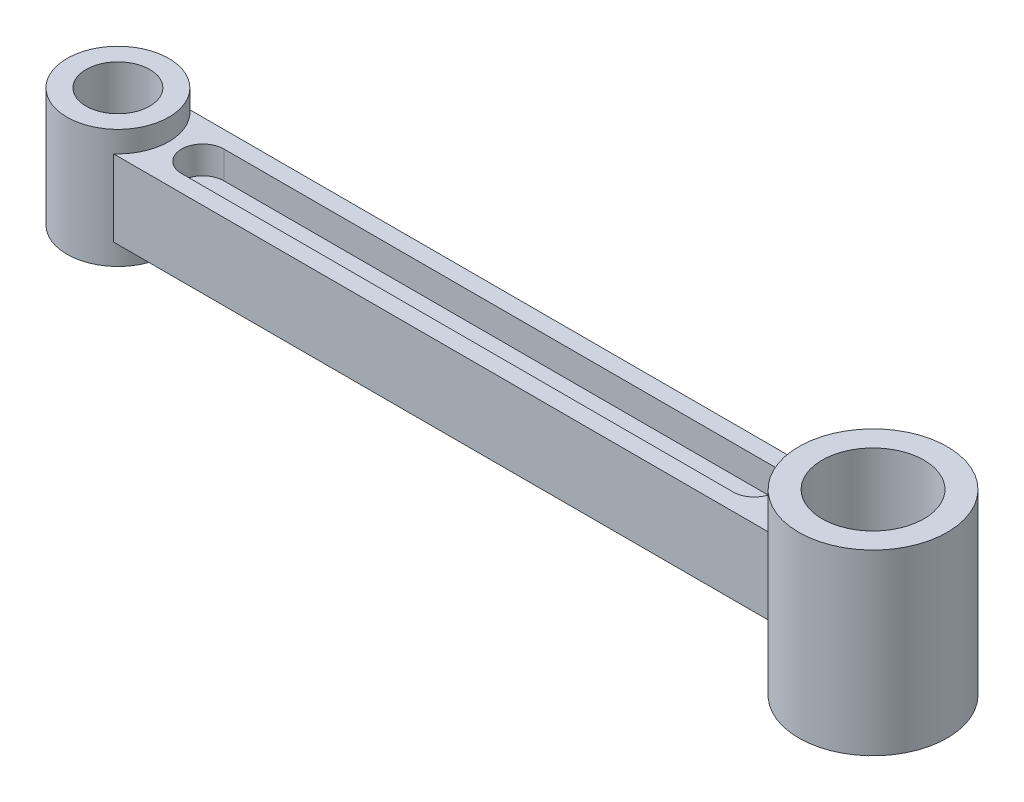
from build123d import *

# Parameters (mm, degrees)
SKETCH1_R           = 7.5
BOSS_EXTRUDE1_DEPTH = 14
SKETCH1_3_R         = 12
BOSS_EXTRUDE2_DEPTH = 21
BOSS_EXTRUDE3_DEPTH = 9
BOSS_EXTRUDE4_DEPTH = 2.5


with BuildPart() as part:
    # Sketch1 → Boss-Extrude1 (new, symmetric)
    with BuildSketch(Plane(origin=(0, 0, 0), x_dir=(1, 0, 0), z_dir=(0, 1, 0))):
        with BuildLine():
            ThreePointArc((12, 0), (10.937253933, 4.937253933), (7.937253933, 9))
            ThreePointArc((7.937253933, 9), (-12, 0), (7.937253933, -9))
            ThreePointArc((7.937253933, -9), (10.937253933, -4.937253933), (12, 0))
        make_face()
        Circle(SKETCH1_R, mode=Mode.SUBTRACT)
    extrude(amount=BOSS_EXTRUDE1_DEPTH, both=True)



with BuildPart() as body_2:
    # Sketch1<3> → Boss-Extrude2 (new, symmetric)
    with BuildSketch(Plane(origin=(0, 0, 0), x_dir=(1, 0, 0), z_dir=(0, 1, 0))):
        with BuildLine():
            ThreePointArc((195.5, 0), (182.669272275, 16.865583193), (162.99166898, 9))
            ThreePointArc((162.99166898, 9), (160.5, 0), (162.99166898, -9))
            ThreePointArc((162.99166898, -9), (182.669272275, -16.865583193), (195.5, 0))
        make_face()
        with Locations((178, 0)):
            Circle(SKETCH1_3_R, mode=Mode.SUBTRACT)
    extrude(amount=BOSS_EXTRUDE2_DEPTH, both=True)


with BuildPart() as part_1:
    add(part.part)

    add(body_2.part)  # Boss-Extrude3 merges body 2
    # Sketch1<4> → Boss-Extrude3 (add, symmetric)
    with BuildSketch(Plane(origin=(0, 0, 0), x_dir=(1, 0, 0), z_dir=(0, 1, 0))):
        with BuildLine():
            ThreePointArc((7.937253933, 9), (12, 0), (7.937253933, -9))
            Line((7.937253933, -9), (162.99166898, -9))
            ThreePointArc((162.99166898, -9), (160.5, 0), (162.99166898, 9))
            Line((162.99166898, 9), (7.937253933, 9))
        make_face()
        with BuildLine():
            ThreePointArc((150, 5), (155, 0), (150, -5))
            Line((150, -5), (20, -5))
            ThreePointArc((20, -5), (15, 0), (20, 5))
            Line((20, 5), (150, 5))
        make_face(mode=Mode.SUBTRACT)
    extrude(amount=BOSS_EXTRUDE3_DEPTH, both=True)

    # Sketch1<5> → Boss-Extrude4 (add, symmetric)
    with BuildSketch(Plane(origin=(0, 0, 0), x_dir=(1, 0, 0), z_dir=(0, 1, 0))):
        with BuildLine():
            ThreePointArc((20, 5), (15, 0), (20, -5))
            Line((20, -5), (150, -5))
            ThreePointArc((150, -5), (155, 0), (150, 5))
            Line((150, 5), (20, 5))
        make_face()
    extrude(amount=BOSS_EXTRUDE4_DEPTH, both=True)


solid = part_1.part
